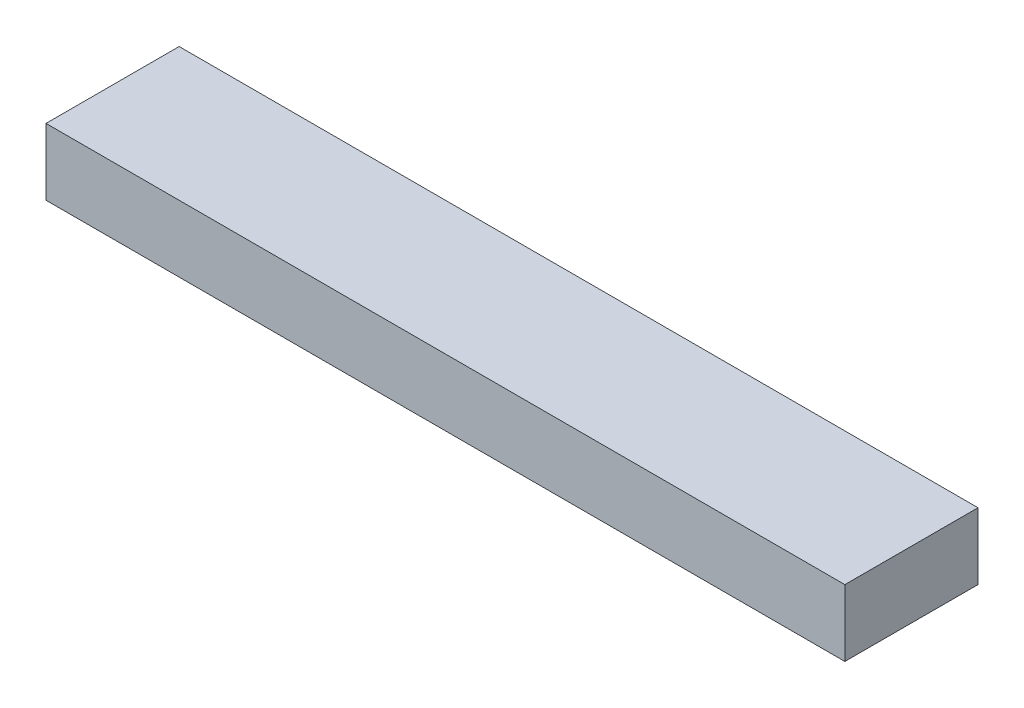
from build123d import *

# Parameters (mm, degrees)
SKETCH1_W           = 38.1
SKETCH1_H           = 6.35
BOSS_EXTRUDE1_DEPTH = 3.175


with BuildPart() as part:
    # Sketch1 → Boss-Extrude1 (new body)
    with BuildSketch(Plane(origin=(0, 0, 0), x_dir=(1, 0, 0), z_dir=(0, 1, 0))):
        with Locations((19.05, 3.175)):
            Rectangle(SKETCH1_W, SKETCH1_H)
    extrude(amount=BOSS_EXTRUDE1_DEPTH)


solid = part.part
